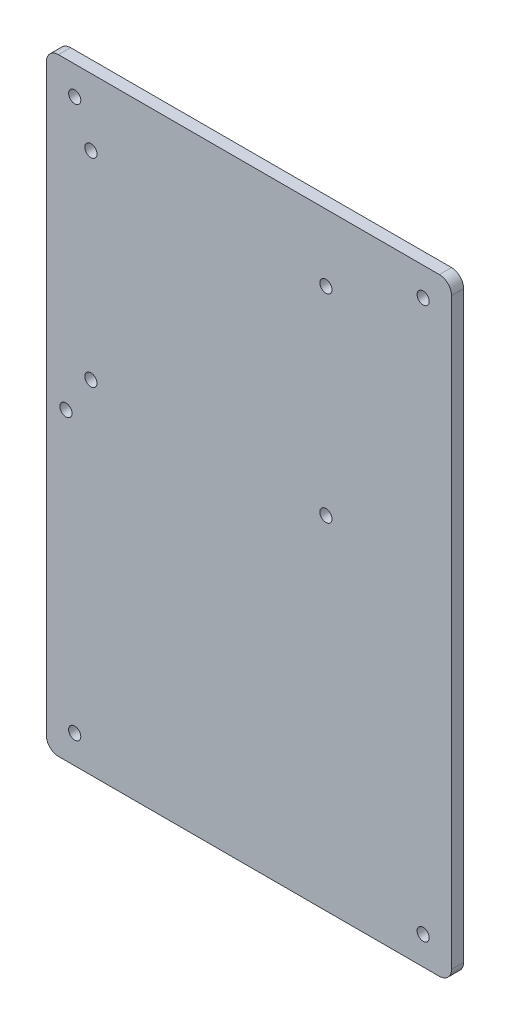
from build123d import *

# Parameters (mm, degrees)
SKETCH_1_R      = 1.5
EXTRUDE_1_DEPTH = 3


with BuildPart() as part:
    # 草图1 → 凸台-拉伸1 (new body)
    with BuildSketch(Plane.XY.offset(43)):
        with BuildLine():
            Line((-102, -62), (-8, -62))
            ThreePointArc((-8, -62), (-5.878679656, -61.121320344), (-5, -59))
            Line((-5, -59), (-5, 85))
            ThreePointArc((-5, 85), (-5.878679656, 87.121320344), (-8, 88))
            Line((-8, 88), (-102, 88))
            ThreePointArc((-102, 88), (-104.121320344, 87.121320344), (-105, 85))
            Line((-105, 85), (-105, -59))
            ThreePointArc((-105, -59), (-104.121320344, -61.121320344), (-102, -62))
        make_face()
        with Locations(Location((-94, 71.5, 0), (0, 0, 180))):
            Circle(SKETCH_1_R, mode=Mode.SUBTRACT)
        with Locations(Location((-94, 22.5, 0), (0, 0, 180))):
            Circle(SKETCH_1_R, mode=Mode.SUBTRACT)
        with Locations(Location((-36, 22.5, 0), (0, 0, 180))):
            Circle(SKETCH_1_R, mode=Mode.SUBTRACT)
        with Locations(Location((-36, 71.5, 0), (0, 0, 180))):
            Circle(SKETCH_1_R, mode=Mode.SUBTRACT)
        with Locations(Location((-100.157022476, 13, 0), (0, 0, 180))):
            Circle(SKETCH_1_R, mode=Mode.SUBTRACT)
        with Locations(Location((-12, 81, 0), (0, 0, 180))):
            Circle(SKETCH_1_R, mode=Mode.SUBTRACT)
        with Locations(Location((-98, -55, 0), (0, 0, 180))):
            Circle(SKETCH_1_R, mode=Mode.SUBTRACT)
        with Locations(Location((-98, 81, 0), (0, 0, 180))):
            Circle(SKETCH_1_R, mode=Mode.SUBTRACT)
        with Locations(Location((-12, -55, 0), (0, 0, 180))):
            Circle(SKETCH_1_R, mode=Mode.SUBTRACT)
    extrude(amount=-EXTRUDE_1_DEPTH)


solid = part.part
